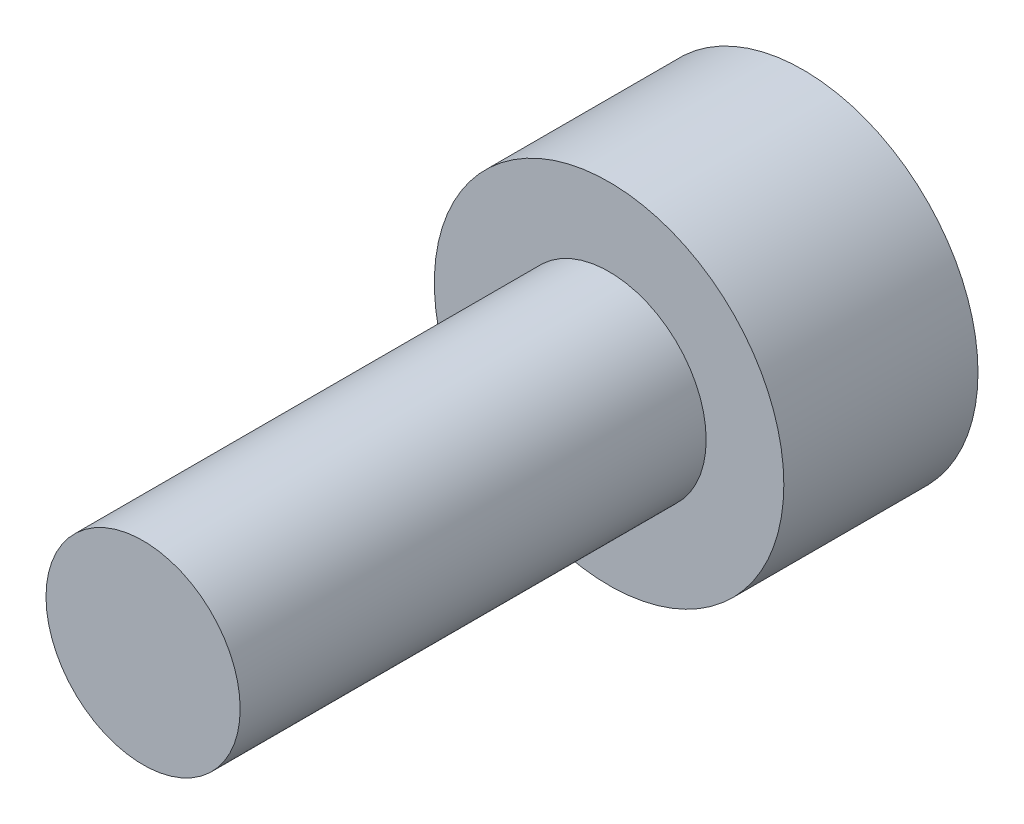
from build123d import *

# Parameters (mm, degrees)
CABEZA_START            = -2.5
SK_CABEZA_R             = 2.25
CABEZA_DEPTH            = 2.5
SK_CUERPO_R             = 1.25
CUERPO_DEPTH            = 6
HEXAGONO_INTERIOR_START = -2.5
HEXAGONO_INTERIOR_DEPTH = 1.25


with BuildPart() as part:
    # Sk_Cabeza → Cabeza (new body)
    with BuildSketch(Plane.XY.offset(CABEZA_START)):
        Circle(SK_CABEZA_R)
    extrude(amount=CABEZA_DEPTH)

    # Sk_Cuerpo → Cuerpo (add)
    with BuildSketch(Plane.XY):
        Circle(SK_CUERPO_R)
    extrude(amount=CUERPO_DEPTH)

    # Sk_Hexagono_interior → Hexagono_interior (cut)
    with BuildSketch(Plane.XY.offset(HEXAGONO_INTERIOR_START)):
        Polygon((0, -1.154700538), (1, -0.577350269), (1, 0.577350269), (0, 1.154700538), (-1, 0.577350269), (-1, -0.577350269), align=None)
    extrude(amount=HEXAGONO_INTERIOR_DEPTH, mode=Mode.SUBTRACT)


solid = part.part
